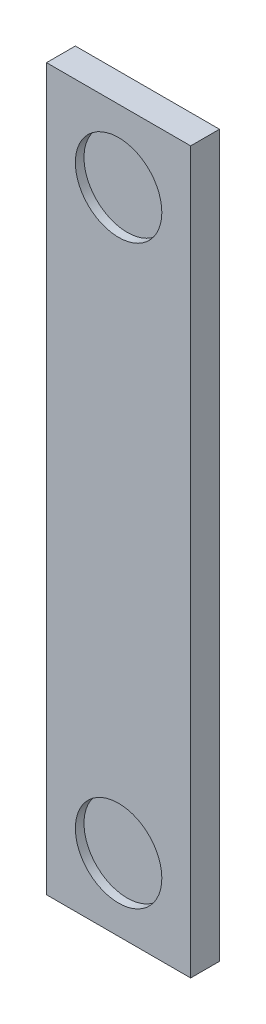
from build123d import *

# Parameters (mm, degrees)
SKETCH1_W           = 50
SKETCH1_H           = 250
BOSS_EXTRUDE1_DEPTH = 5
SKETCH2_R           = 15
CUT_EXTRUDE1_DEPTH  = 3


with BuildPart() as part:
    # Sketch1 → Boss-Extrude1 (new, symmetric)
    with BuildSketch(Plane.XY):
        Rectangle(SKETCH1_W, SKETCH1_H)
    extrude(amount=BOSS_EXTRUDE1_DEPTH, both=True)

    # Sketch2 → Cut-Extrude1 (cut)
    with BuildSketch(Plane.XY.offset(5)):
        with Locations((0, 100)):
            Circle(SKETCH2_R)
        with Locations((0, -100)):
            Circle(SKETCH2_R)
    extrude(amount=-CUT_EXTRUDE1_DEPTH, mode=Mode.SUBTRACT)


solid = part.part
